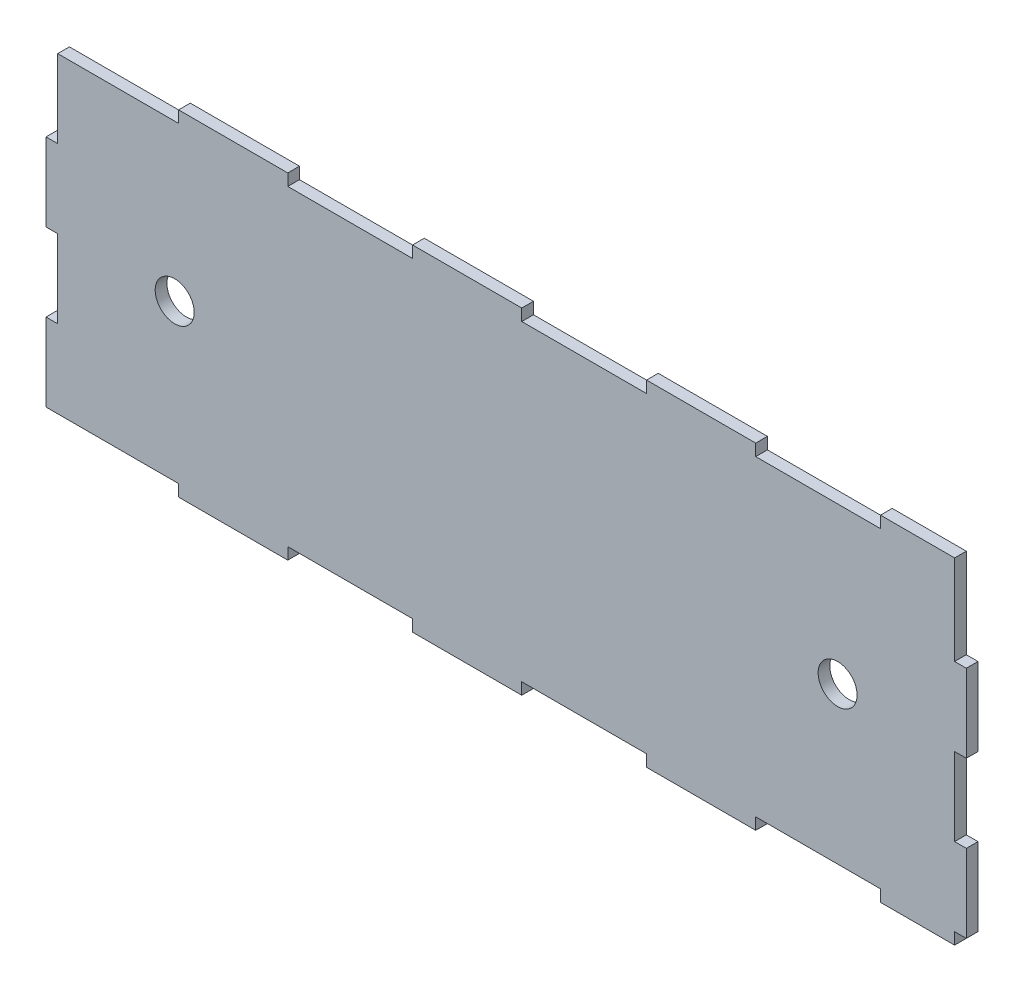
from build123d import *

# Parameters (mm, degrees)
ESQUISSE2_W             = 230
ESQUISSE2_H             = 80
BOSS_EXTRU_1_DEPTH      = 3
ESQUISSE3_W             = 28
ESQUISSE3_H             = 3
ESQUISSE3_W_2           = 19
BOSS_EXTRU_2_DEPTH      = 3
ESQUISSE5_W             = 5.353052469
ESQUISSE5_H             = 20
ESQUISSE5_W_2           = 7.144707487
BOSS_EXTRU_3_DEPTH      = 3
ENL_V_MAT_EXTRU_2_DEPTH = 10
ESQUISSE8_W             = 2.353052469
ESQUISSE8_H             = 20
ENL_V_MAT_EXTRU_3_DEPTH = 10
ESQUISSE9_R             = 5
ENL_V_MAT_EXTRU_4_DEPTH = 10


with BuildPart() as part:
    # Esquisse2 → Boss.-Extru.1 (new body)
    with BuildSketch(Plane.XY):
        with Locations((115, 40)):
            Rectangle(ESQUISSE2_W, ESQUISSE2_H)
    extrude(amount=BOSS_EXTRU_1_DEPTH)

    # Esquisse3 → Boss.-Extru.2 (add)
    with BuildSketch(Plane(origin=(0, 0, 0), x_dir=(-1, 0, 0), z_dir=(0, 0, -1))):
        with Locations((-45, 81.5)):
            Rectangle(ESQUISSE3_W, ESQUISSE3_H)
        with Locations((-105, 81.5)):
            Rectangle(ESQUISSE3_W, ESQUISSE3_H)
        with Locations((-165, 81.5)):
            Rectangle(ESQUISSE3_W, ESQUISSE3_H)
        with Locations((-220.5, 81.5)):
            Rectangle(ESQUISSE3_W_2, ESQUISSE3_H)
        with Locations((-45, -1.5)):
            Rectangle(ESQUISSE3_W, ESQUISSE3_H)
        with Locations((-105, -1.5)):
            Rectangle(ESQUISSE3_W, ESQUISSE3_H)
        with Locations((-165, -1.5)):
            Rectangle(ESQUISSE3_W, ESQUISSE3_H)
        with Locations((-220.5, -1.5)):
            Rectangle(ESQUISSE3_W_2, ESQUISSE3_H)
    extrude(amount=-BOSS_EXTRU_2_DEPTH)

    # Esquisse5 → Boss.-Extru.3 (add)
    with BuildSketch(Plane(origin=(0, 0, 0), x_dir=(-1, 0, 0), z_dir=(0, 0, -1))):
        with Locations((2.676526235, 10)):
            Rectangle(ESQUISSE5_W, ESQUISSE5_H)
        with Locations((3.572353744, 50)):
            Rectangle(ESQUISSE5_W_2, ESQUISSE5_H)
        with Locations((-232.676526235, 10)):
            Rectangle(ESQUISSE5_W, ESQUISSE5_H)
        with Locations((-233.572353744, 50)):
            Rectangle(ESQUISSE5_W_2, ESQUISSE5_H)
    extrude(amount=-BOSS_EXTRU_3_DEPTH)

    # Esquisse7 → Enlèv. mat.-Extru.2 (cut)
    with BuildSketch(Plane.XY.offset(3)):
        Polygon((237.144707487, 60), (233, 60), (233, 20), (235.353052469, 20), (235.353052469, 0), (233, 0), (233, -1.758999091), (237.903552449, -1.758999091), (237.903552449, 40), (237.144707487, 40), align=None)
        Polygon((-3, 20), (-3, 60), (-7.903552449, 60), (-7.903552449, -1.758999091), (-3, -1.758999091), (-3, 0), (-5.353052469, 0), (-5.353052469, 20), align=None)
    extrude(amount=-ENL_V_MAT_EXTRU_2_DEPTH, mode=Mode.SUBTRACT)

    # Esquisse8 → Enlèv. mat.-Extru.3 (cut)
    with BuildSketch(Plane(origin=(0, 0, 0), x_dir=(-1, 0, 0), z_dir=(0, 0, -1))):
        with Locations((-234.176526235, 10)):
            Rectangle(ESQUISSE8_W, ESQUISSE8_H)
        with Locations((4.176526235, 10)):
            Rectangle(ESQUISSE8_W, ESQUISSE8_H)
    extrude(amount=-ENL_V_MAT_EXTRU_3_DEPTH, mode=Mode.SUBTRACT)

    # Esquisse9 → Enlèv. mat.-Extru.4 (cut)
    with BuildSketch(Plane.XY.offset(3)):
        with Locations((30, 40)):
            Circle(ESQUISSE9_R)
        with Locations((200, 40)):
            Circle(ESQUISSE9_R)
    extrude(amount=-ENL_V_MAT_EXTRU_4_DEPTH, mode=Mode.SUBTRACT)


solid = part.part
